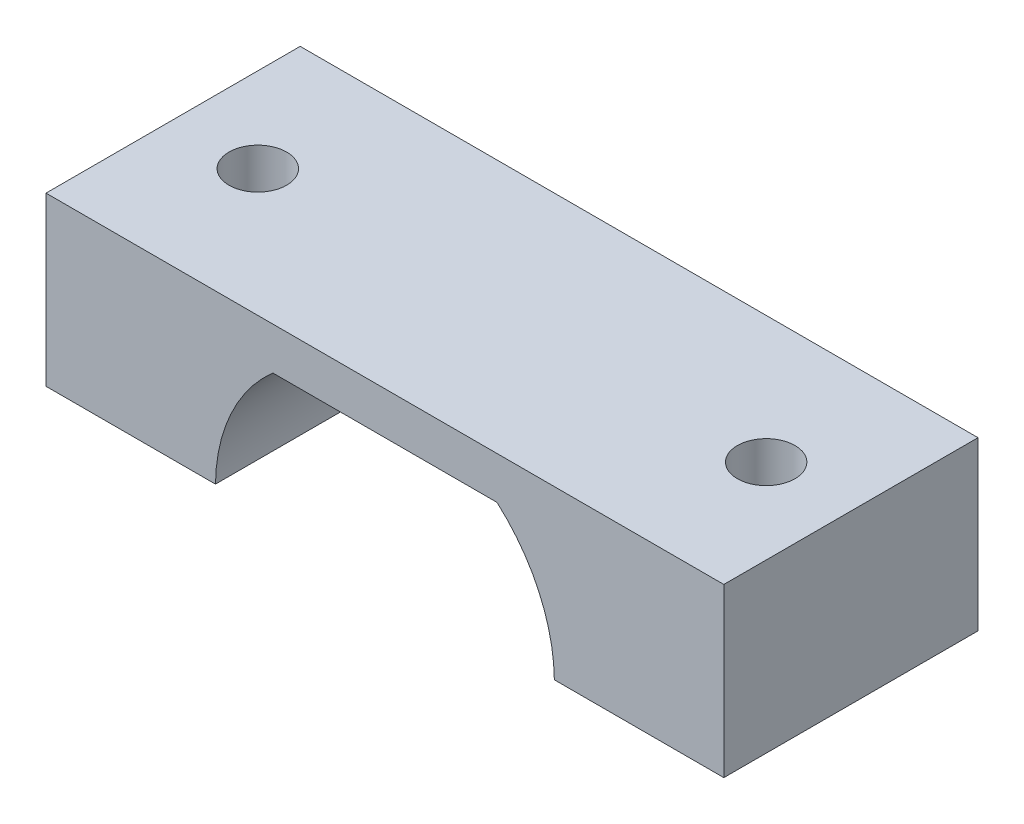
from build123d import *

# Parameters (mm, degrees)
MOTOR_CLAMP_OUTLINE_SOLID_DEPTH     = 7.5
MOTOR_CLAMP_MOUNTING_HOLES_SKETCH_R = 1.7
MOTOR_CLAMP_MOUNTING_HOLE_CUT_DEPTH = 24.532225245


with BuildPart() as part:
    # Motor Clamp Outline Sketch → Motor Clamp Outline Solid (new, symmetric)
    with BuildSketch(Plane.XY):
        with BuildLine():
            Line((-20, 0.125), (-9.999218719, 0.125))
            ThreePointArc((-9.999218719, 0.125), (-9.088484887, 4.171263892), (-6.614378278, 7.5))
            Line((-6.614378278, 7.5), (6.614378278, 7.5))
            ThreePointArc((6.614378278, 7.5), (9.088484887, 4.171263892), (9.999218719, 0.125))
            Line((9.999218719, 0.125), (20, 0.125))
            Line((20, 0.125), (20, 10))
            Line((20, 10), (-20, 10))
            Line((-20, 10), (-20, 0.125))
        make_face()
    extrude(amount=MOTOR_CLAMP_OUTLINE_SOLID_DEPTH, both=True)

    # Motor Clamp Mounting Holes Sketch → Motor Clamp Mounting Hole Cut (cut, through all)
    with BuildSketch(Plane(origin=(0, 10, 0), x_dir=(1, 0, 0), z_dir=(0, 1, 0))):
        with Locations(Location((-15, 0, 0), (0, 0, 270))):
            Circle(MOTOR_CLAMP_MOUNTING_HOLES_SKETCH_R)
        with Locations(Location((15, 0, 0), (0, 0, 270))):
            Circle(MOTOR_CLAMP_MOUNTING_HOLES_SKETCH_R)
    extrude(amount=-MOTOR_CLAMP_MOUNTING_HOLE_CUT_DEPTH, mode=Mode.SUBTRACT)


solid = part.part
